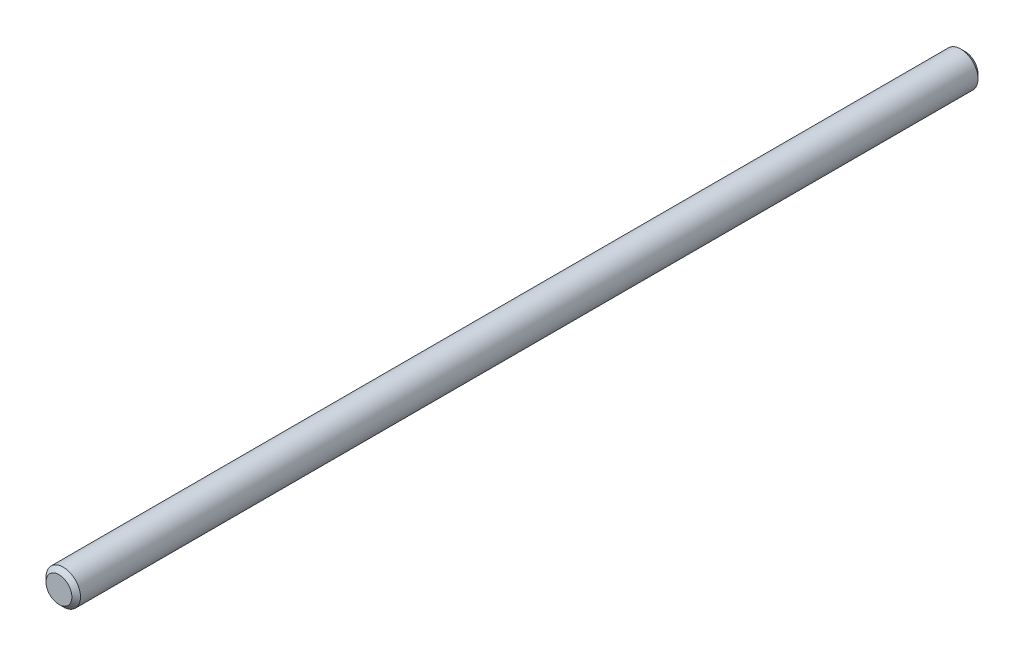
from build123d import *

# Parameters (mm, degrees)
SKICA1_R                = 4
P_IDAT_VYSUNUT_M1_DEPTH = 210
ZKOSEN_1_SIZE           = 1


with BuildPart() as part:
    # Skica1 → Přidat vysunutím1 (new body)
    with BuildSketch(Plane.XY):
        Circle(SKICA1_R)
    extrude(amount=P_IDAT_VYSUNUT_M1_DEPTH)

    # Zkosení1
    zkosen_1_edges = [part.edges().sort_by_distance(p)[0] for p in [
        (-4, 0, 0),
        (-4, 0, 210),
    ]]
    chamfer(zkosen_1_edges, length=ZKOSEN_1_SIZE)


solid = part.part
